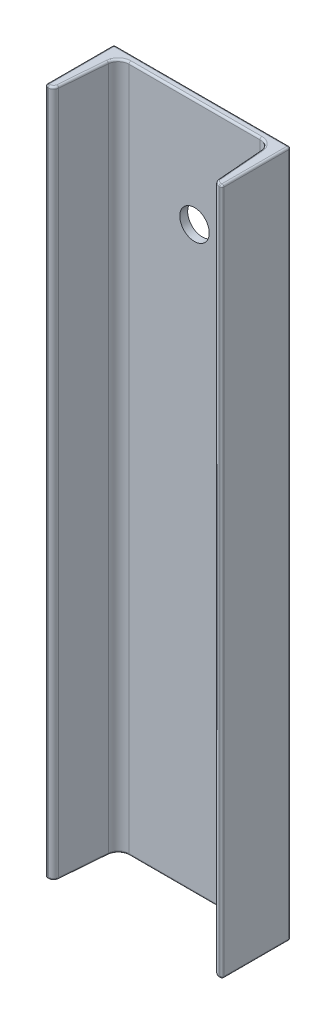
from build123d import *

# Parameters (mm, degrees)
UPN_UPN180_1_DEPTH = 700
SKETCH128_R        = 15
CUT_EXTRUDE1_DEPTH = 10
FILLET1_R          = 2


with BuildPart() as part:
    # Sketch133 → Upn UPN180(1) (new body)
    with BuildSketch(Plane.ZX.offset(-309.124087591)):
        with BuildLine():
            Line((70, 180), (0, 180))
            Line((0, 180), (0, 0))
            Line((0, 0), (70, 0))
            Line((70, 0), (70, 3.122386663))
            ThreePointArc((70, 3.122386663), (68.541183887, 6.853181859), (64.938606257, 8.604870092))
            Line((64.938606257, 8.604870092), (18.122787486, 12.350200343))
            ThreePointArc((18.122787486, 12.350200343), (10.917632226, 15.85357681), (8, 23.315167202))
            Line((8, 23.315167202), (8, 156.684832798))
            ThreePointArc((8, 156.684832798), (10.917632226, 164.14642319), (18.122787486, 167.649799657))
            Line((18.122787486, 167.649799657), (64.938606257, 171.395129908))
            ThreePointArc((64.938606257, 171.395129908), (68.541183887, 173.146818141), (70, 176.877613337))
            Line((70, 176.877613337), (70, 180))
        make_face()
    extrude(amount=UPN_UPN180_1_DEPTH)

    # Sketch128 → Cut-Extrude1 (cut)
    with BuildSketch(Plane.XY.offset(8)):
        with Locations((90, 280.875912409)):
            Circle(SKETCH128_R)
    extrude(amount=-CUT_EXTRUDE1_DEPTH, mode=Mode.SUBTRACT)

    # Fillet1
    fillet1_edges = [part.edges().sort_by_distance(p)[0] for p in [
        (169.522464782, -309.124087591, 41.530696872),
        (164.14642319, -309.124087591, 10.917632226),
        (180, 390.875912409, 35),
        (90, -309.124087591, 8),
        (15.85357681, -309.124087591, 10.917632226),
        (10.477535218, -309.124087591, 41.530696872),
        (6.853181859, -309.124087591, 68.541183887),
        (1.561193332, -309.124087591, 70),
        (0, -309.124087591, 35),
        (90, -309.124087591, 0),
        (180, -309.124087591, 35),
        (178.438806668, -309.124087591, 70),
        (173.146818141, -309.124087591, 68.541183887),
        (90, 390.875912409, 0),
        (0, 390.875912409, 35),
        (0, 40.875912409, 70),
        (0, 40.875912409, 0),
        (180, 40.875912409, 0),
        (180, 40.875912409, 70),
        (1.561193332, 390.875912409, 70),
        (6.853181859, 390.875912409, 68.541183887),
        (10.477535218, 390.875912409, 41.530696872),
        (15.85357681, 390.875912409, 10.917632226),
        (90, 390.875912409, 8),
        (164.14642319, 390.875912409, 10.917632226),
        (169.522464782, 390.875912409, 41.530696872),
        (173.146818141, 390.875912409, 68.541183887),
        (178.438806668, 390.875912409, 70),
    ]]
    fillet(fillet1_edges, radius=FILLET1_R)


solid = part.part
